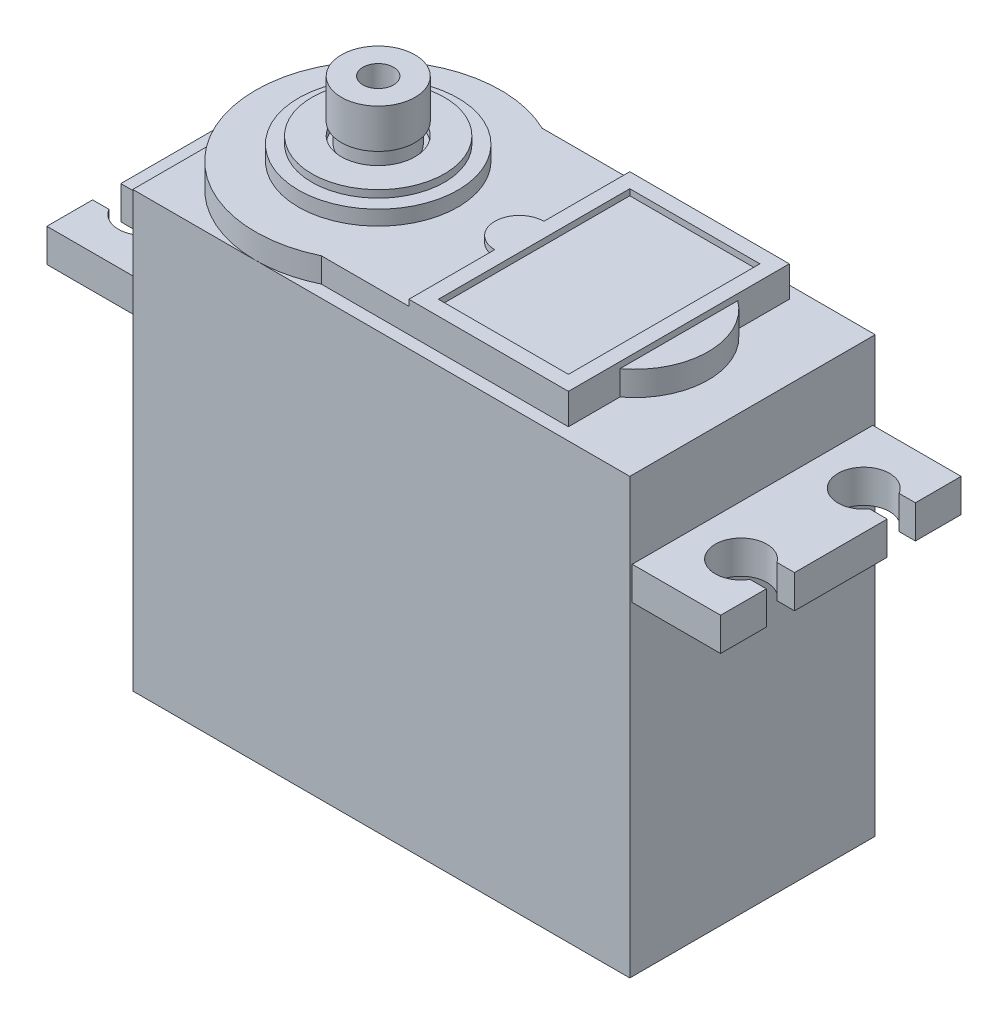
from build123d import *

# Parameters (mm, degrees)
SKETCH1_W           = 40.5
SKETCH1_H           = 20
BOSS_EXTRUDE1_DEPTH = 37
SKETCH2_W           = 19.6
SKETCH2_H           = 2.7
BOSS_EXTRUDE2_DEPTH = 7.2
CUT_EXTRUDE1_DEPTH  = 43.379151714
BOSS_EXTRUDE3_DEPTH = 2
SKETCH6_R           = 6.5
BOSS_EXTRUDE4_DEPTH = 1.2
SKETCH7_R           = 5.4
BOSS_EXTRUDE5_DEPTH = 0.6
SKETCH8_R           = 3
SKETCH8_R_2         = 2.6
CUT_EXTRUDE2_DEPTH  = 0.6
BOSS_EXTRUDE6_START = 1
SKETCH9_R           = 2.6
BOSS_EXTRUDE6_DEPTH = 1
BOSS_EXTRUDE7_START = 3.2
SKETCH10_R          = 3
BOSS_EXTRUDE7_DEPTH = 3.2
SKETCH11_R          = 1.25
CUT_EXTRUDE3_DEPTH  = 10
SKETCH12_W          = 10.6
SKETCH12_H          = 15.6
BOSS_EXTRUDE8_DEPTH = 0.5
CHAMFER1_SIZE       = 1.6
SKETCH13_W          = 7
SKETCH13_H          = 4
BOSS_EXTRUDE9_DEPTH = 5.2
DRAFT1_ANGLE        = 10


with BuildPart() as part:
    # Sketch1 → Boss-Extrude1 (new body)
    with BuildSketch(Plane(origin=(0, 0, 0), x_dir=(1, 0, 0), z_dir=(0, 1, 0))):
        Rectangle(SKETCH1_W, SKETCH1_H)
    extrude(amount=BOSS_EXTRUDE1_DEPTH)

    # Sketch2 → Boss-Extrude2 (add)
    with BuildSketch(Plane.ZY.offset(20.25)):
        with Locations((0, 29.35)):
            Rectangle(SKETCH2_W, SKETCH2_H)
    boss_extrude2 = extrude(amount=BOSS_EXTRUDE2_DEPTH)

    # Sketch3 → Cut-Extrude1 (cut, through all)
    with BuildSketch(Plane(origin=(0, 30.7, 0), x_dir=(1, 0, 0), z_dir=(0, 1, 0))):
        with BuildLine():
            Line((-27.45, -3.775463215), (-27.45, -6.073333333))
            Line((-27.45, -6.073333333), (-26.121072803, -6.073333333))
            ThreePointArc((-26.121072803, -6.073333333), (-22.218036714, -5.090354029), (-26.022113628, -3.775463215))
            Line((-26.022113628, -3.775463215), (-27.45, -3.775463215))
        make_face()
        with BuildLine():
            Line((-26.121072803, 6.073333333), (-27.45, 6.073333333))
            Line((-27.45, 6.073333333), (-27.45, 3.775463215))
            Line((-27.45, 3.775463215), (-26.022113628, 3.775463215))
            ThreePointArc((-26.022113628, 3.775463215), (-22.218036714, 5.090354029), (-26.121072803, 6.073333333))
        make_face()
    cut_extrude1 = extrude(amount=-CUT_EXTRUDE1_DEPTH, mode=Mode.SUBTRACT)

    # Mirror2: Boss-Extrude2, Cut-Extrude1 across plane
    add(boss_extrude2.mirror(Plane(origin=(0, 0, 0), x_dir=(0, 0, 1), z_dir=(1, 0, 0))))
    add(cut_extrude1.mirror(Plane(origin=(0, 0, 0), x_dir=(0, 0, 1), z_dir=(1, 0, 0))), mode=Mode.SUBTRACT)

    # Sketch5 → Boss-Extrude3 (add)
    with BuildSketch(Plane(origin=(0, 37, 0), x_dir=(1, 0, 0), z_dir=(0, 1, 0))):
        with BuildLine():
            Line((-5.891101056, -9), (14.25, -9))
            Line((14.25, -9), (14.25, -4.8))
            ThreePointArc((14.25, -4.8), (16.65, 0), (14.25, 4.8))
            Line((14.25, 4.8), (14.25, 9))
            Line((14.25, 9), (-5.891101056, 9))
            ThreePointArc((-5.891101056, 9), (-20.25, 0), (-5.891101056, -9))
        make_face()
    extrude(amount=BOSS_EXTRUDE3_DEPTH)

    # Sketch6 → Boss-Extrude4 (add)
    with BuildSketch(Plane(origin=(0, 39, 0), x_dir=(1, 0, 0), z_dir=(0, 1, 0))):
        with Locations(Location((-10.25, 0, 0), (0, 0, 270))):
            Circle(SKETCH6_R)
    extrude(amount=BOSS_EXTRUDE4_DEPTH)

    # Sketch7 → Boss-Extrude5 (add)
    with BuildSketch(Plane(origin=(0, 40.2, 0), x_dir=(1, 0, 0), z_dir=(0, 1, 0))):
        with Locations(Location((-10.25, 0, 0), (0, 0, 270))):
            Circle(SKETCH7_R)
    extrude(amount=BOSS_EXTRUDE5_DEPTH)

    # Sketch8 → Cut-Extrude2 (cut)
    with BuildSketch(Plane(origin=(0, 40.8, 0), x_dir=(1, 0, 0), z_dir=(0, 1, 0))):
        with Locations(Location((-10.25, 0, 0), (0, 0, 270))):
            Circle(SKETCH8_R)
        with Locations(Location((-10.25, 0, 0), (0, 0, 270))):
            Circle(SKETCH8_R_2, mode=Mode.SUBTRACT)
    extrude(amount=-CUT_EXTRUDE2_DEPTH, mode=Mode.SUBTRACT)

    # Sketch9 → Boss-Extrude6 (add)
    with BuildSketch(Plane(origin=(0, 40.8, 0), x_dir=(1, 0, 0), z_dir=(0, 1, 0)).offset(BOSS_EXTRUDE6_START)):
        with Locations(Location((-10.25, 0, 0), (0, 0, 270))):
            Circle(SKETCH9_R)
    extrude(amount=-BOSS_EXTRUDE6_DEPTH)

    # Sketch10 → Boss-Extrude7 (add)
    with BuildSketch(Plane(origin=(0, 41.8, 0), x_dir=(1, 0, 0), z_dir=(0, 1, 0)).offset(BOSS_EXTRUDE7_START)):
        with Locations(Location((-10.25, 0, 0), (0, 0, 270))):
            Circle(SKETCH10_R)
    extrude(amount=-BOSS_EXTRUDE7_DEPTH)

    # Sketch11 → Cut-Extrude3 (cut)
    with BuildSketch(Plane(origin=(0, 45, 0), x_dir=(1, 0, 0), z_dir=(0, 1, 0))):
        with Locations(Location((-10.25, 0, 0), (0, 0, 270))):
            Circle(SKETCH11_R)
    extrude(amount=-CUT_EXTRUDE3_DEPTH, mode=Mode.SUBTRACT)

    # Sketch12 → Boss-Extrude8 (add)
    with BuildSketch(Plane(origin=(0, 39, 0), x_dir=(1, 0, 0), z_dir=(0, 1, 0))):
        with BuildLine():
            Line((14.25, 9), (1.25, 9))
            Line((1.25, 9), (1.25, 2))
            ThreePointArc((1.25, 2), (-0.75, 0), (1.25, -2))
            Line((1.25, -2), (1.25, -9))
            Line((1.25, -9), (14.25, -9))
            Line((14.25, -9), (14.25, 9))
        make_face()
        with Locations((7.75, 0)):
            Rectangle(SKETCH12_W, SKETCH12_H, mode=Mode.SUBTRACT)
    extrude(amount=BOSS_EXTRUDE8_DEPTH)

    # Chamfer1
    chamfer1_edges = [part.edges().sort_by_distance(p)[0] for p in [
        (0, 0, 10),
        (20.25, 0, 0),
        (0, 0, -10),
        (-20.25, 0, 0),
    ]]
    chamfer(chamfer1_edges, length=CHAMFER1_SIZE)

    # Sketch13 → Boss-Extrude9 (add)
    with BuildSketch(Plane.ZY.offset(20.25)):
        with Locations((0, 5.7)):
            Rectangle(SKETCH13_W, SKETCH13_H)
    extrude(amount=BOSS_EXTRUDE9_DEPTH)

    # Draft1
    draft1_faces = [part.faces().sort_by_distance(p)[0] for p in [
        (-22.85, 7.7, 0),
        (-22.85, 5.7, 3.5),
        (-22.85, 5.7, -3.5),
        (-22.85, 3.7, 0),
    ]]
    draft(draft1_faces, Plane(origin=(-20.25, 37, 10), x_dir=(0, 0, -1), z_dir=(-1, 0, 0)), DRAFT1_ANGLE)


solid = part.part
